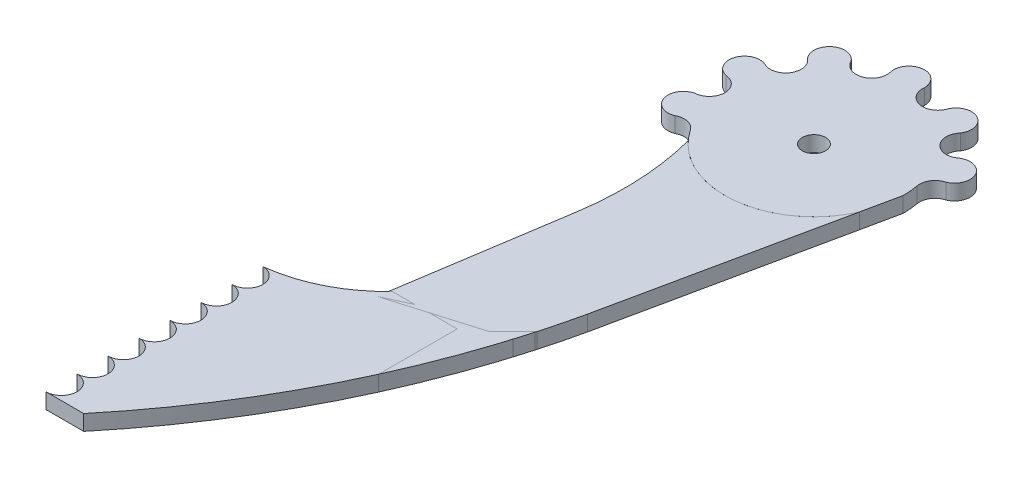
from build123d import *

# Parameters (mm, degrees)
SKETCH1_R           = 1.5
BOSS_EXTRUDE3_DEPTH = 1
BOSS_EXTRUDE5_DEPTH = 1
BOSS_EXTRUDE7_DEPTH = 1
BOSS_EXTRUDE8_DEPTH = 1
CUT_EXTRUDE2_DEPTH  = 1


with BuildPart() as part:
    # Sketch1 → Boss-Extrude3 (new, symmetric)
    with BuildSketch(Plane(origin=(0, 0, 0), x_dir=(1, 0, 0), z_dir=(0, 1, 0))):
        with BuildLine():
            Line((10.514574075, -4.657653059), (11.5, 0))
            ThreePointArc((11.5, 0), (11.456239027, 1.002291054), (11.325289155, 1.996954068))
            ThreePointArc((11.325289155, 1.996954068), (11.611650109, 3.42436803), (12.789931133, 4.279451094))
            ThreePointArc((12.789931133, 4.279451094), (13.810601125, 7.036852746), (10.979881559, 7.831873403))
            ThreePointArc((10.979881559, 7.831873403), (8.272407704, 7.98857126), (8.210294777, 10.699864472))
            ThreePointArc((8.210294777, 10.699864472), (7.514549114, 13.556605461), (4.723206327, 12.632789163))
            ThreePointArc((4.723206327, 12.632789163), (2.390984444, 11.248697408), (0.823354571, 13.461728244))
            ThreePointArc((0.823354571, 13.461728244), (-1.350914013, 15.44101782), (-3.148450543, 13.114240322))
            ThreePointArc((-3.148450543, 13.114240322), (-4.307975824, 10.662614328), (-6.845111027, 11.620692539))
            ThreePointArc((-6.845111027, 11.620692539), (-9.754466061, 12.045762403), (-9.943573918, 9.111606762))
            ThreePointArc((-9.943573918, 9.111606762), (-9.533932084, 6.43071839), (-12.173063031, 5.806253224))
            ThreePointArc((-12.173063031, 5.806253224), (-14.822723717, 4.531761423), (-13.338742224, 1.993488382))
            ThreePointArc((-13.338742224, 1.993488382), (-11.500173028, -0.026307423), (-13.391237031, -1.997040464))
            ThreePointArc((-13.391237031, -1.997040464), (-14.817426803, -4.548498719), (-12.174900262, -5.797902564))
            ThreePointArc((-12.174900262, -5.797902564), (-10.733949165, -5.596544571), (-9.537839858, -6.424921076))
            ThreePointArc((-9.537839858, -6.424921076), (1.009609575, -11.455596384), (10.514574075, -4.657653059))
        make_face()
        with Locations(Location((0, 0, 0), (0, 0, 270))):
            Circle(SKETCH1_R, mode=Mode.SUBTRACT)
    extrude(amount=BOSS_EXTRUDE3_DEPTH, both=True)


with BuildPart() as body_2:
    # Sketch1<5> → Boss-Extrude5 (new, symmetric)
    with BuildSketch(Plane(origin=(0, 0, 0), x_dir=(1, 0, 0), z_dir=(0, 1, 0))):
        with BuildLine():
            Line((2.806807826, -41.088702969), (10.514574075, -4.657653059))
            ThreePointArc((10.514574075, -4.657653059), (1.846708509, -11.35075626), (-8.495825279, -7.750545324))
            ThreePointArc((-8.495825279, -7.750545324), (-7.347088724, -15.263704681), (-7.738414168, -22.854094893))
            Line((-7.738414168, -22.854094893), (-11.192007229, -45.231550072))
            Line((-11.192007229, -45.231550072), (2.806807826, -41.088702969))
        make_face()
    extrude(amount=BOSS_EXTRUDE5_DEPTH, both=True)


with BuildPart() as body_3:
    # Sketch2 → Boss-Extrude7 (new, symmetric)
    with BuildSketch(Plane(origin=(0, 0, 0), x_dir=(1, 0, 0), z_dir=(0, 1, 0))):
        with BuildLine():
            Line((-2.371433126, -72.667068493), (-2.371433126, -43.697049279))
            Line((-2.371433126, -43.697049279), (-10.753114724, -43.697049279))
            ThreePointArc((-10.753114724, -43.697049279), (-15.600240159, -47.350930238), (-21.380122364, -49.205231385))
            ThreePointArc((-21.380122364, -49.205231385), (-21.632355968, -49.254495275), (-21.888824426, -49.271007455))
            ThreePointArc((-21.888824426, -49.271007455), (-20.474610864, -49.856793893), (-19.888824426, -51.271007455))
            ThreePointArc((-19.888824426, -51.271007455), (-20.474610864, -52.685221018), (-21.888824426, -53.271007455))
            ThreePointArc((-21.888824426, -53.271007455), (-20.474610864, -53.856793893), (-19.888824426, -55.271007455))
            ThreePointArc((-19.888824426, -55.271007455), (-20.474610866, -56.68522102), (-21.888824433, -57.271007455))
            ThreePointArc((-21.888824433, -57.271007455), (-20.474610866, -57.85679389), (-19.888824426, -59.271007455))
            ThreePointArc((-19.888824426, -59.271007455), (-20.474610864, -60.685221018), (-21.888824426, -61.271007455))
            ThreePointArc((-21.888824426, -61.271007455), (-20.474610864, -61.856793893), (-19.888824426, -63.271007455))
            ThreePointArc((-19.888824426, -63.271007455), (-20.474610864, -64.685221018), (-21.888824426, -65.271007455))
            ThreePointArc((-21.888824426, -65.271007455), (-20.474610864, -65.856793893), (-19.888824426, -67.271007455))
            ThreePointArc((-19.888824426, -67.271007455), (-20.474610864, -68.685221018), (-21.888824426, -69.271007455))
            ThreePointArc((-21.888824426, -69.271007455), (-20.474610864, -69.856793893), (-19.888824426, -71.271007455))
            ThreePointArc((-19.888824426, -71.271007455), (-20.474610864, -72.685221018), (-21.888824426, -73.271007455))
            ThreePointArc((-21.888824426, -73.271007455), (-20.474610864, -73.856793893), (-19.888824426, -75.271007455))
            ThreePointArc((-19.888824426, -75.271007455), (-20.474610864, -76.685221018), (-21.888824426, -77.271007455))
            Line((-21.888824426, -77.271007455), (-12.155084024, -77.271007455))
            ThreePointArc((-12.155084024, -77.271007455), (-6.995429189, -75.538191741), (-2.371433126, -72.667068493))
        make_face()
    extrude(amount=BOSS_EXTRUDE7_DEPTH, both=True)


with BuildPart() as body_4:
    # Sketch2<5> → Boss-Extrude8 (new, symmetric)
    with BuildSketch(Plane(origin=(0, 0, 0), x_dir=(1, 0, 0), z_dir=(0, 1, 0))):
        Polygon((-10.753114724, -43.697049279), (-2.371433126, -43.697049279), (-2.371433126, -72.667068493), (3.384279509, -38.732055606), align=None)
    extrude(amount=BOSS_EXTRUDE8_DEPTH, both=True)


with BuildPart() as cut_extrude2_tool:
    # Sketch3 → Cut-Extrude2 (new, symmetric)
    with BuildSketch(Plane(origin=(0, 0, 0), x_dir=(1, 0, 0), z_dir=(0, 1, 0))):
        with BuildLine():
            Line((-17.021954225, -77.271007455), (4.891566987, -77.271007455))
            Line((4.891566987, -77.271007455), (4.891566987, -31.235009619))
            ThreePointArc((4.891566987, -31.235009619), (-3.20178666, -55.616014274), (-17.021954225, -77.271007455))
        make_face()
    extrude(amount=CUT_EXTRUDE2_DEPTH, both=True)


with BuildPart() as body_2_1:
    add(body_2.part)

    # Cut-Extrude2: cut by cut_extrude2_tool
    add(cut_extrude2_tool.part, mode=Mode.SUBTRACT)


with BuildPart() as body_3_1:
    add(body_3.part)

    # Cut-Extrude2: cut by cut_extrude2_tool
    add(cut_extrude2_tool.part, mode=Mode.SUBTRACT)


with BuildPart() as body_4_1:
    add(body_4.part)

    # Cut-Extrude2: cut by cut_extrude2_tool
    add(cut_extrude2_tool.part, mode=Mode.SUBTRACT)


solid = Compound([part.part, body_2_1.part, body_3_1.part, body_4_1.part])
